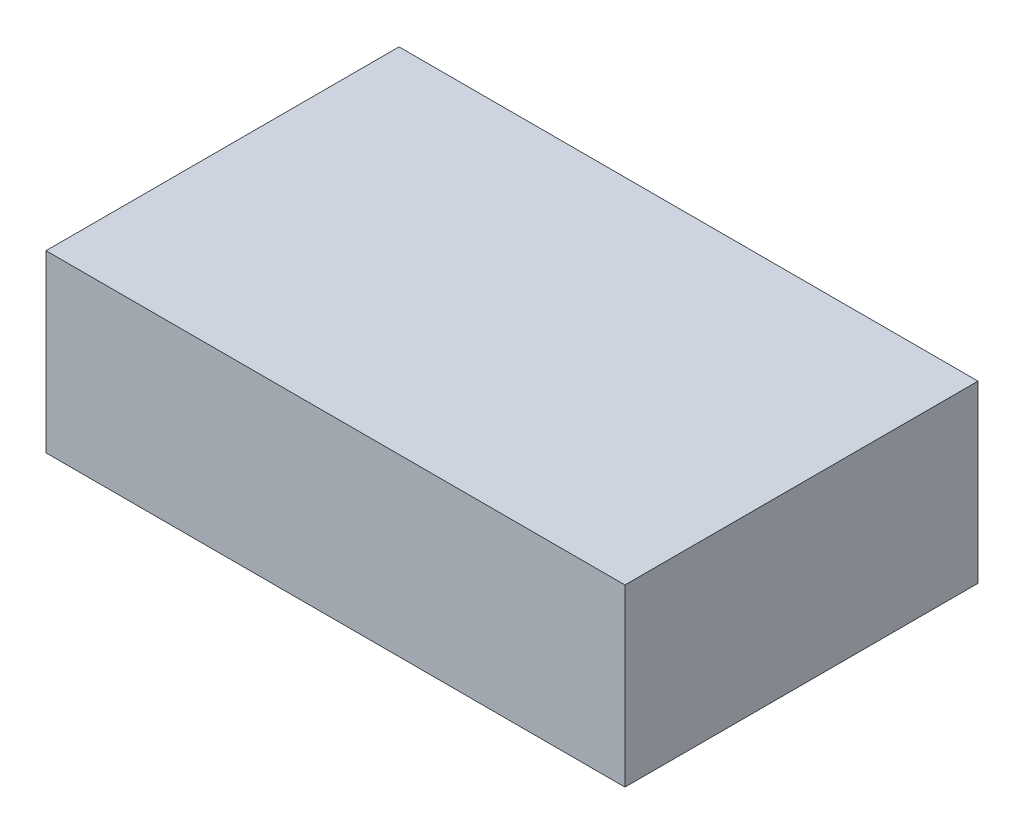
from build123d import *

# Parameters (mm, degrees)
SKETCH_2_W          = 102.5
SKETCH_2_H          = 62.5
EXTRUDE_2_DEPTH     = 31
SKETCH_3_R          = 1.25
CUT_EXTRUDE_1_DEPTH = 5


with BuildPart() as part:
    # 草图2 → 凸台-拉伸2 (new body)
    with BuildSketch(Plane(origin=(0, 0, 0), x_dir=(1, 0, 0), z_dir=(0, 1, 0))):
        Rectangle(SKETCH_2_W, SKETCH_2_H)
    extrude(amount=EXTRUDE_2_DEPTH)

    # 草图3 → 切除-拉伸1 (cut)
    with BuildSketch(Plane.XZ):
        with Locations(Location((-30, 20, 0), (0, 0, 270))):
            Circle(SKETCH_3_R)
        with Locations(Location((30, 20, 0), (0, 0, 270))):
            Circle(SKETCH_3_R)
        with Locations(Location((30, -20, 0), (0, 0, 270))):
            Circle(SKETCH_3_R)
        with Locations(Location((-30, -20, 0), (0, 0, 270))):
            Circle(SKETCH_3_R)
    extrude(amount=-CUT_EXTRUDE_1_DEPTH, mode=Mode.SUBTRACT)


solid = part.part
